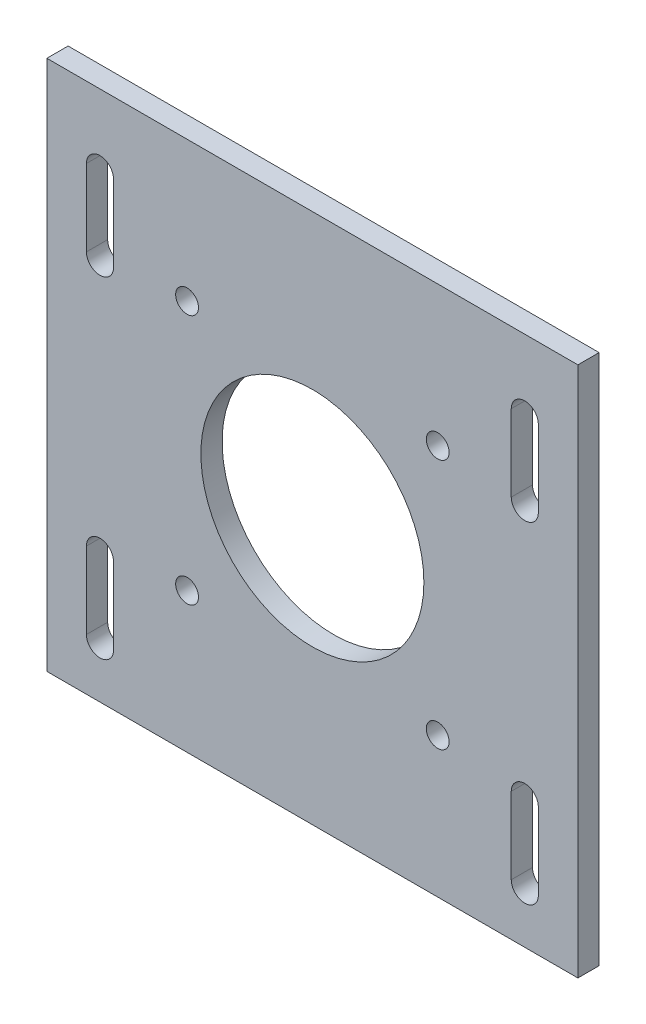
from build123d import *

# Parameters (mm, degrees)
SKETCH1_R           = 2.15
SKETCH1_R_2         = 21
BOSS_EXTRUDE1_DEPTH = 4


with BuildPart() as part:
    # Sketch1 → Boss-Extrude1 (new body)
    with BuildSketch(Plane.XY):
        Polygon((0, 0), (0, 90), (100, 90), (100, 2.372295937), (100, -10), (0, -10), align=None)
        with Locations((26.4, 63.6)):
            Circle(SKETCH1_R, mode=Mode.SUBTRACT)
        with Locations((73.6, 63.6)):
            Circle(SKETCH1_R, mode=Mode.SUBTRACT)
        with Locations((73.6, 16.4)):
            Circle(SKETCH1_R, mode=Mode.SUBTRACT)
        with Locations((26.4, 16.4)):
            Circle(SKETCH1_R, mode=Mode.SUBTRACT)
        with Locations((50, 40)):
            Circle(SKETCH1_R_2, mode=Mode.SUBTRACT)
        with BuildLine():
            Line((7.45, 14.17243776), (7.45, -0.25030049))
            ThreePointArc((7.45, -0.25030049), (10, -2.80030049), (12.55, -0.25030049))
            Line((12.55, -0.25030049), (12.55, 14.17243776))
            ThreePointArc((12.55, 14.17243776), (10, 16.72243776), (7.45, 14.17243776))
        make_face(mode=Mode.SUBTRACT)
        with BuildLine():
            Line((87.45, 62.150571419), (87.45, 76.57330967))
            ThreePointArc((87.45, 76.57330967), (90, 79.12330967), (92.55, 76.57330967))
            Line((92.55, 76.57330967), (92.55, 62.150571419))
            ThreePointArc((92.55, 62.150571419), (90, 59.600571419), (87.45, 62.150571419))
        make_face(mode=Mode.SUBTRACT)
        with BuildLine():
            Line((92.55, 14.17243776), (92.55, -0.25030049))
            ThreePointArc((92.55, -0.25030049), (90, -2.80030049), (87.45, -0.25030049))
            Line((87.45, -0.25030049), (87.45, 14.17243776))
            ThreePointArc((87.45, 14.17243776), (90, 16.72243776), (92.55, 14.17243776))
        make_face(mode=Mode.SUBTRACT)
        with BuildLine():
            Line((12.55, 62.150571419), (12.55, 76.57330967))
            ThreePointArc((12.55, 76.57330967), (10, 79.12330967), (7.45, 76.57330967))
            Line((7.45, 76.57330967), (7.45, 62.150571419))
            ThreePointArc((7.45, 62.150571419), (10, 59.600571419), (12.55, 62.150571419))
        make_face(mode=Mode.SUBTRACT)
    extrude(amount=BOSS_EXTRUDE1_DEPTH)


solid = part.part
